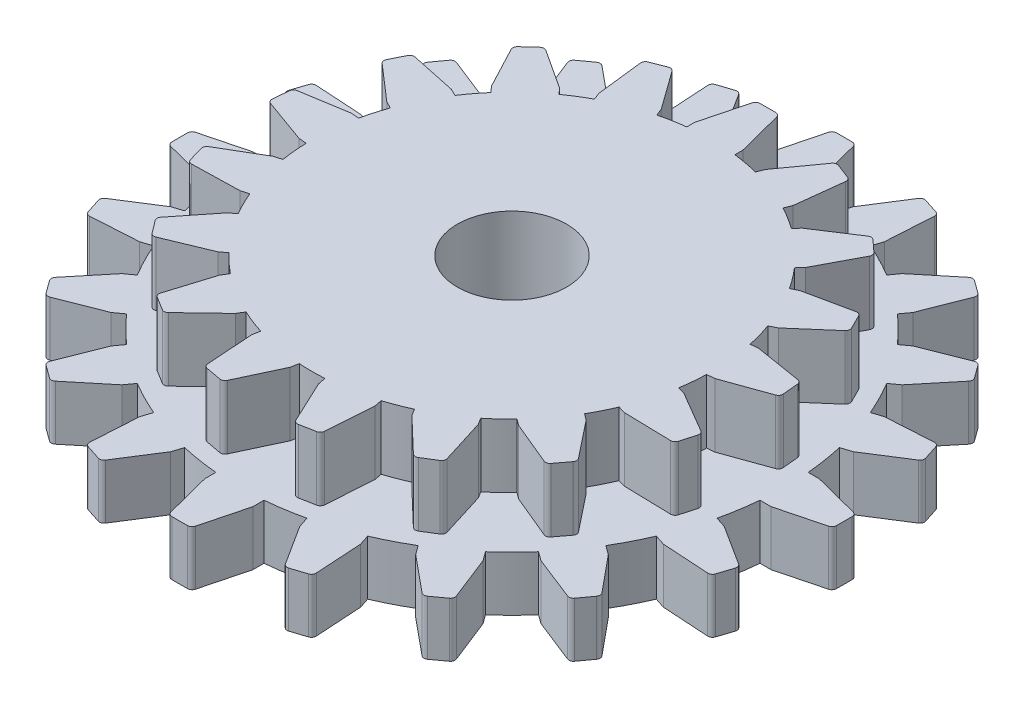
from build123d import *

# Parameters (mm, degrees)
BOSS_EXTRUDE1_DEPTH      = 3
FILLET1_R                = 0.25
CIRPATTERN1_COUNT        = 20
FILLET1_OF_CIRPATTERN1_R = 0.25
BOSS_EXTRUDE2_DEPTH      = 6.5
CIRPATTERN2_COUNT        = 17


with BuildPart() as part:
    # Sketch1 → Revolve1 (revolve)
    with BuildSketch(Plane.XY, mode=Mode.PRIVATE) as revolve1_sk:
        Polygon((3, 6.5), (3, 0), (15, 0), (15, 3), (11, 3), (11, 6.5), align=None)
    revolve(revolve1_sk.sketch.rotate(Axis((0, 0, 0), (0, 1, 0)), 90), axis=Axis((0, 0, 0), (0, 1, 0)))

    # Sketch2 → Boss-Extrude1 (add)
    with BuildSketch(Plane(origin=(0, 0, 0), x_dir=(1, 0, 0), z_dir=(0, 1, 0))):
        Polygon((-1.323267478, 14.75), (-1.323267478, 15.55), (-0.625, 18.25), (0.625, 18.25), (1.323267478, 15.55), (1.323267478, 14.75), align=None)
    boss_extrude1 = extrude(amount=BOSS_EXTRUDE1_DEPTH)

    # Fillet1
    fillet1_edges = [part.edges().sort_by_distance(p)[0] for p in [
        (-0.625, 1.5, -18.25),
        (0.625, 1.5, -18.25),
    ]]
    fillet(fillet1_edges, radius=FILLET1_R)

    # CirPattern1: Boss-Extrude1 ×20 about axis
    cirpattern1_axis = Axis((0, 0, 0), (0, 1, 0))
    for i in range(1, CIRPATTERN1_COUNT):
        add(boss_extrude1.rotate(cirpattern1_axis, i * 360 / CIRPATTERN1_COUNT))

    # Fillet1 of CirPattern1
    fillet1_of_cirpattern1_edges = [part.edges().sort_by_distance(p)[0] for p in [
        (-6.23397047, 1.5, -17.163645801),
        (-5.045149825, 1.5, -17.549917044),
        (-11.232716476, 1.5, -14.397194365),
        (-10.221445233, 1.5, -15.13192593),
        (-15.13192593, 1.5, -10.221445233),
        (-14.397194365, 1.5, -11.232716476),
        (-17.549917044, 1.5, -5.045149825),
        (-17.163645801, 1.5, -6.23397047),
        (-18.25, 1.5, 0.625),
        (-18.25, 1.5, -0.625),
        (-17.163645801, 1.5, 6.23397047),
        (-17.549917044, 1.5, 5.045149825),
        (-14.397194365, 1.5, 11.232716476),
        (-15.13192593, 1.5, 10.221445233),
        (-10.221445233, 1.5, 15.13192593),
        (-11.232716476, 1.5, 14.397194365),
        (-5.045149825, 1.5, 17.549917044),
        (-6.23397047, 1.5, 17.163645801),
        (0.625, 1.5, 18.25),
        (-0.625, 1.5, 18.25),
        (6.23397047, 1.5, 17.163645801),
        (5.045149825, 1.5, 17.549917044),
        (11.232716476, 1.5, 14.397194365),
        (10.221445233, 1.5, 15.13192593),
        (15.13192593, 1.5, 10.221445233),
        (14.397194365, 1.5, 11.232716476),
        (17.549917044, 1.5, 5.045149825),
        (17.163645801, 1.5, 6.23397047),
        (18.25, 1.5, -0.625),
        (18.25, 1.5, 0.625),
        (17.163645801, 1.5, -6.23397047),
        (17.549917044, 1.5, -5.045149825),
        (14.397194365, 1.5, -11.232716476),
        (15.13192593, 1.5, -10.221445233),
        (10.221445233, 1.5, -15.13192593),
        (11.232716476, 1.5, -14.397194365),
        (5.045149825, 1.5, -17.549917044),
        (6.23397047, 1.5, -17.163645801),
    ]]
    fillet(fillet1_of_cirpattern1_edges, radius=FILLET1_OF_CIRPATTERN1_R)

    # Sketch3 → Boss-Extrude2 (add)
    with BuildSketch(Plane(origin=(0, 0, 0), x_dir=(1, 0, 0), z_dir=(0, 1, 0))):
        with BuildLine():
            Line((1.323267478, 11.35), (1.323267478, 10.741518102))
            Line((1.323267478, 10.741518102), (-1.323267478, 10.741518102))
            Line((-1.323267478, 10.741518102), (-1.323267478, 11.35))
            Line((-1.323267478, 11.35), (-0.673466228, 13.862595001))
            ThreePointArc((-0.673466228, 13.862595001), (-0.584483638, 13.997672393), (-0.431429318, 14.05))
            Line((-0.431429318, 14.05), (0.431429318, 14.05))
            ThreePointArc((0.431429318, 14.05), (0.584483638, 13.997672393), (0.673466228, 13.862595001))
            Line((0.673466228, 13.862595001), (1.323267478, 11.35))
        make_face()
    boss_extrude2 = extrude(amount=BOSS_EXTRUDE2_DEPTH)

    # CirPattern2: Boss-Extrude2 ×17 about axis
    cirpattern2_axis = Axis((0, 0, 0), (0, 1, 0))
    for i in range(1, CIRPATTERN2_COUNT):
        add(boss_extrude2.rotate(cirpattern2_axis, i * 360 / CIRPATTERN2_COUNT))


solid = part.part
